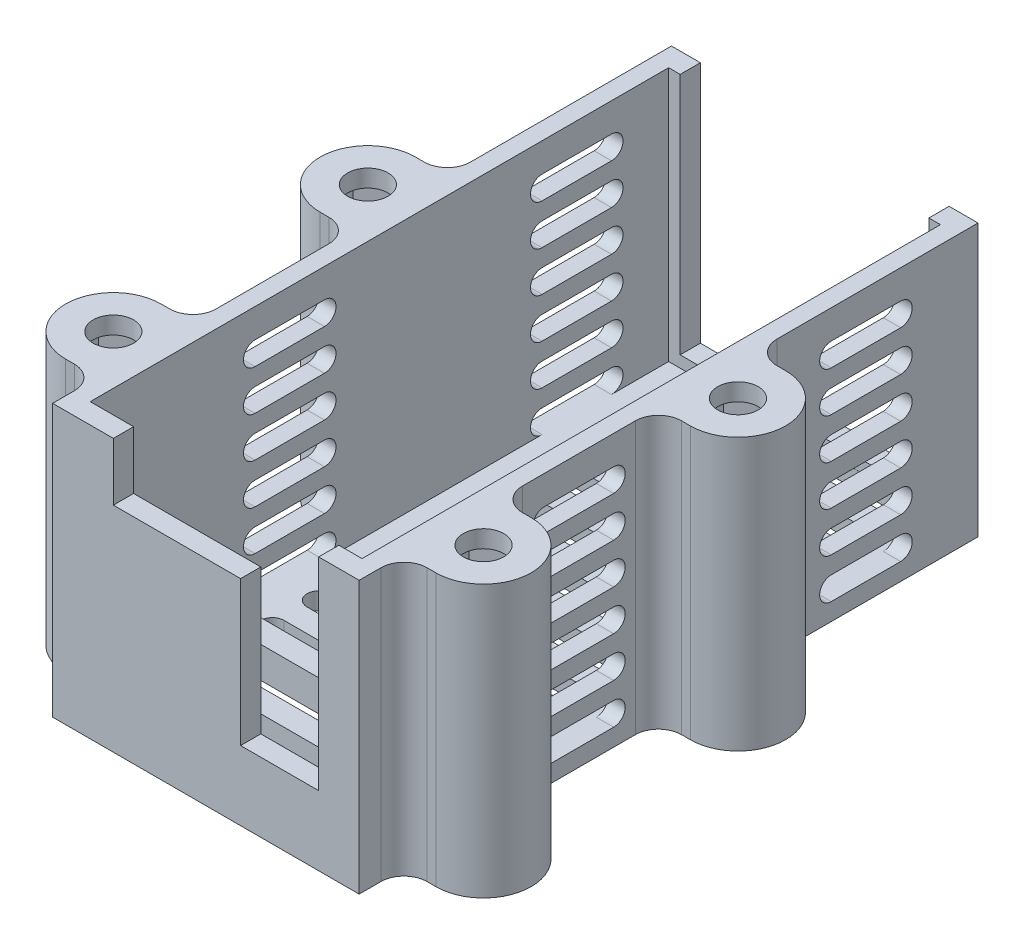
from build123d import *

# Parameters (mm, degrees)
SKETCH1_R           = 1.75
BOSS_EXTRUDE2_DEPTH = 1.5
SKETCH2_R           = 1.75
SKETCH2_W           = 23.5
SKETCH2_H           = 50.005253482
BOSS_EXTRUDE3_DEPTH = 22
SKETCH3_W           = 21.5
SKETCH3_H           = 1.747373259
CUT_EXTRUDE1_DEPTH  = 21
CUT_EXTRUDE2_REACH  = 63.802
SKETCH4_W           = 11
SKETCH4_H           = 2
SKETCH4_W_2         = 5
SKETCH4_H_2         = 3
CUT_EXTRUDE3_DEPTH  = 22
CUT_EXTRUDE4_REACH  = 42.9
SKETCH7_W           = 23.5
SKETCH7_H           = 2
BOSS_EXTRUDE4_DEPTH = 1.2
CUT_EXTRUDE5_REACH  = 50.803
FILLET1_R           = 2


with BuildPart() as part:
    # Sketch1 → Boss-Extrude2 (new body)
    with BuildSketch(Plane(origin=(0, 0, 0), x_dir=(1, 0, 0), z_dir=(0, 1, 0))):
        with BuildLine():
            Line((13.25, -26.75), (13.25, -22.875))
            Line((13.25, -22.875), (16, -22.875))
            ThreePointArc((16, -22.875), (20.125, -18.75), (16, -14.625))
            Line((16, -14.625), (13.25, -14.625))
            Line((13.25, -14.625), (13.25, -0.875))
            Line((13.25, -0.875), (16, -0.875))
            ThreePointArc((16, -0.875), (20.125, 3.25), (16, 7.375))
            Line((16, 7.375), (13.25, 7.375))
            Line((13.25, 7.375), (13.25, 26.75))
            Line((13.25, 26.75), (-13.25, 26.75))
            Line((-13.25, 26.75), (-13.25, 7.375))
            Line((-13.25, 7.375), (-16, 7.375))
            ThreePointArc((-16, 7.375), (-20.125, 3.25), (-16, -0.875))
            Line((-16, -0.875), (-13.25, -0.875))
            Line((-13.25, -0.875), (-13.25, -14.625))
            Line((-13.25, -14.625), (-16, -14.625))
            ThreePointArc((-16, -14.625), (-20.125, -18.75), (-16, -22.875))
            Line((-16, -22.875), (-13.25, -22.875))
            Line((-13.25, -22.875), (-13.25, -26.75))
            Line((-13.25, -26.75), (13.25, -26.75))
        make_face()
        with Locations(Location((16, -18.75, 0), (0, 0, 270))):
            Circle(SKETCH1_R, mode=Mode.SUBTRACT)
        with Locations(Location((-16, 3.25, 0), (0, 0, 270))):
            Circle(SKETCH1_R, mode=Mode.SUBTRACT)
        with Locations(Location((16, 3.25, 0), (0, 0, 270))):
            Circle(SKETCH1_R, mode=Mode.SUBTRACT)
        with Locations(Location((-16, -18.75, 0), (0, 0, 270))):
            Circle(SKETCH1_R, mode=Mode.SUBTRACT)
    extrude(amount=BOSS_EXTRUDE2_DEPTH)

    # Sketch2 → Boss-Extrude3 (add)
    with BuildSketch(Plane(origin=(0, 1.5, 0), x_dir=(1, 0, 0), z_dir=(0, 1, 0))):
        with BuildLine():
            Line((13.25, 26.75), (-13.25, 26.75))
            Line((-13.25, 26.75), (-13.25, 7.375))
            Line((-13.25, 7.375), (-16, 7.375))
            ThreePointArc((-16, 7.375), (-20.125, 3.25), (-16, -0.875))
            Line((-16, -0.875), (-13.25, -0.875))
            Line((-13.25, -0.875), (-13.25, -14.625))
            Line((-13.25, -14.625), (-16, -14.625))
            ThreePointArc((-16, -14.625), (-20.125, -18.75), (-16, -22.875))
            Line((-16, -22.875), (-13.25, -22.875))
            Line((-13.25, -22.875), (-13.25, -26.75))
            Line((-13.25, -26.75), (13.25, -26.75))
            Line((13.25, -26.75), (13.25, -22.875))
            Line((13.25, -22.875), (16, -22.875))
            ThreePointArc((16, -22.875), (20.125, -18.75), (16, -14.625))
            Line((16, -14.625), (13.25, -14.625))
            Line((13.25, -14.625), (13.25, -0.875))
            Line((13.25, -0.875), (16, -0.875))
            ThreePointArc((16, -0.875), (20.125, 3.25), (16, 7.375))
            Line((16, 7.375), (13.25, 7.375))
            Line((13.25, 7.375), (13.25, 26.75))
        make_face()
        with Locations(Location((-16, 3.25, 0), (0, 0, 270))):
            Circle(SKETCH2_R, mode=Mode.SUBTRACT)
        with Locations(Location((-16, -18.75, 0), (0, 0, 270))):
            Circle(SKETCH2_R, mode=Mode.SUBTRACT)
        with Locations(Location((16, -18.75, 0), (0, 0, 270))):
            Circle(SKETCH2_R, mode=Mode.SUBTRACT)
        with Locations(Location((16, 3.25, 0), (0, 0, 270))):
            Circle(SKETCH2_R, mode=Mode.SUBTRACT)
        Rectangle(SKETCH2_W, SKETCH2_H, mode=Mode.SUBTRACT)
    extrude(amount=BOSS_EXTRUDE3_DEPTH)

    # Sketch3 → Cut-Extrude1 (cut)
    with BuildSketch(Plane(origin=(0, 23.5, 0), x_dir=(1, 0, 0), z_dir=(0, 1, 0))):
        with Locations((0, 25.876313371)):
            Rectangle(SKETCH3_W, SKETCH3_H)
    extrude(amount=-CUT_EXTRUDE1_DEPTH, mode=Mode.SUBTRACT)

    # Sketch4 → Cut-Extrude2 (cut, up to next)
    with BuildSketch(Plane.XY.offset(26.75), mode=Mode.PRIVATE) as cut_extrude2_sk1:
        with Locations((-2.5, 22.5)):
            Rectangle(SKETCH4_W, SKETCH4_H)
    cut_extrude2_tool1 = extrude(cut_extrude2_sk1.sketch, amount=-CUT_EXTRUDE2_REACH, mode=Mode.PRIVATE) & part.part
    # Sketch4 → Cut-Extrude2 (cut, up to next)
    with BuildSketch(Plane.XY.offset(26.75), mode=Mode.PRIVATE) as cut_extrude2_sk2:
        with Locations((5.5, 22.5)):
            Rectangle(SKETCH4_W_2, SKETCH4_H)
    cut_extrude2_tool2 = extrude(cut_extrude2_sk2.sketch, amount=-CUT_EXTRUDE2_REACH, mode=Mode.PRIVATE) & part.part
    # Sketch4 → Cut-Extrude2 (cut, up to next)
    with BuildSketch(Plane.XY.offset(26.75), mode=Mode.PRIVATE) as cut_extrude2_sk3:
        Polygon((3, 6), (9.75, 6), (9.75, 23.5), (8, 23.5), (8, 21.5), (8, 18.5), (3, 18.5), align=None)
    cut_extrude2_tool3 = extrude(cut_extrude2_sk3.sketch, amount=-CUT_EXTRUDE2_REACH, mode=Mode.PRIVATE) & part.part
    # Sketch4 → Cut-Extrude2 (cut, up to next)
    with BuildSketch(Plane.XY.offset(26.75), mode=Mode.PRIVATE) as cut_extrude2_sk4:
        with Locations((5.5, 20)):
            Rectangle(SKETCH4_W_2, SKETCH4_H_2)
    cut_extrude2_tool4 = extrude(cut_extrude2_sk4.sketch, amount=-CUT_EXTRUDE2_REACH, mode=Mode.PRIVATE) & part.part
    # Sketch4 → Cut-Extrude2 (cut, up to next)
    with BuildSketch(Plane.XY.offset(26.75), mode=Mode.PRIVATE) as cut_extrude2_sk5:
        with Locations((-2.5, 20)):
            Rectangle(SKETCH4_W, SKETCH4_H_2)
    cut_extrude2_tool5 = extrude(cut_extrude2_sk5.sketch, amount=-CUT_EXTRUDE2_REACH, mode=Mode.PRIVATE) & part.part
    add(cut_extrude2_tool1.solids().sort_by_distance((-2.5, 22.5, 26.75))[0], mode=Mode.SUBTRACT)
    add(cut_extrude2_tool2.solids().sort_by_distance((5.5, 22.5, 26.75))[0], mode=Mode.SUBTRACT)
    add(cut_extrude2_tool3.solids().sort_by_distance((6.609899, 13.072148, 26.75))[0], mode=Mode.SUBTRACT)
    add(cut_extrude2_tool4.solids().sort_by_distance((5.5, 20, 26.75))[0], mode=Mode.SUBTRACT)
    add(cut_extrude2_tool5.solids().sort_by_distance((-2.5, 20, 26.75))[0], mode=Mode.SUBTRACT)

    # Sketch5 → Cut-Extrude3 (cut)
    with BuildSketch(Plane.XZ):
        Polygon((-16, 15.285898385), (-13, 17.017949192), (-13, 20.482050808), (-16, 22.214101615), (-19, 20.482050808), (-19, 17.017949192), align=None)
        Polygon((16, 15.285898385), (19, 17.017949192), (19, 20.482050808), (16, 22.214101615), (13, 20.482050808), (13, 17.017949192), align=None)
        Polygon((16, -6.714101615), (19, -4.982050808), (19, -1.517949192), (16, 0.214101615), (13, -1.517949192), (13, -4.982050808), align=None)
        Polygon((-16, -6.714101615), (-13, -4.982050808), (-13, -1.517949192), (-16, 0.214101615), (-19, -1.517949192), (-19, -4.982050808), align=None)
    extrude(amount=-CUT_EXTRUDE3_DEPTH, mode=Mode.SUBTRACT)

    # Sketch6 → Cut-Extrude4 (cut, up to next)
    with BuildSketch(Plane.XZ, mode=Mode.PRIVATE) as cut_extrude4_sk1:
        with BuildLine():
            Line((-9, 1), (9, 1))
            ThreePointArc((9, 1), (10, 0), (9, -1))
            Line((9, -1), (-9, -1))
            ThreePointArc((-9, -1), (-10, 0), (-9, 1))
        make_face()
    cut_extrude4_tool1 = extrude(cut_extrude4_sk1.sketch, amount=-CUT_EXTRUDE4_REACH, mode=Mode.PRIVATE) & part.part
    # Sketch6 → Cut-Extrude4 (cut, up to next)
    with BuildSketch(Plane.XZ, mode=Mode.PRIVATE) as cut_extrude4_sk2:
        with BuildLine():
            Line((-9, 5), (9, 5))
            ThreePointArc((9, 5), (10, 4), (9, 3))
            Line((9, 3), (-9, 3))
            ThreePointArc((-9, 3), (-10, 4), (-9, 5))
        make_face()
    cut_extrude4_tool2 = extrude(cut_extrude4_sk2.sketch, amount=-CUT_EXTRUDE4_REACH, mode=Mode.PRIVATE) & part.part
    # Sketch6 → Cut-Extrude4 (cut, up to next)
    with BuildSketch(Plane.XZ, mode=Mode.PRIVATE) as cut_extrude4_sk3:
        with BuildLine():
            Line((-9, 9), (9, 9))
            ThreePointArc((9, 9), (10, 8), (9, 7))
            Line((9, 7), (-9, 7))
            ThreePointArc((-9, 7), (-10, 8), (-9, 9))
        make_face()
    cut_extrude4_tool3 = extrude(cut_extrude4_sk3.sketch, amount=-CUT_EXTRUDE4_REACH, mode=Mode.PRIVATE) & part.part
    # Sketch6 → Cut-Extrude4 (cut, up to next)
    with BuildSketch(Plane.XZ, mode=Mode.PRIVATE) as cut_extrude4_sk4:
        with BuildLine():
            Line((-9, 13), (9, 13))
            ThreePointArc((9, 13), (10, 12), (9, 11))
            Line((9, 11), (-9, 11))
            ThreePointArc((-9, 11), (-10, 12), (-9, 13))
        make_face()
    cut_extrude4_tool4 = extrude(cut_extrude4_sk4.sketch, amount=-CUT_EXTRUDE4_REACH, mode=Mode.PRIVATE) & part.part
    # Sketch6 → Cut-Extrude4 (cut, up to next)
    with BuildSketch(Plane.XZ, mode=Mode.PRIVATE) as cut_extrude4_sk5:
        with BuildLine():
            Line((-9, 17), (9, 17))
            ThreePointArc((9, 17), (10, 16), (9, 15))
            Line((9, 15), (-9, 15))
            ThreePointArc((-9, 15), (-10, 16), (-9, 17))
        make_face()
    cut_extrude4_tool5 = extrude(cut_extrude4_sk5.sketch, amount=-CUT_EXTRUDE4_REACH, mode=Mode.PRIVATE) & part.part
    # Sketch6 → Cut-Extrude4 (cut, up to next)
    with BuildSketch(Plane.XZ, mode=Mode.PRIVATE) as cut_extrude4_sk6:
        with BuildLine():
            Line((-9, 21), (9, 21))
            ThreePointArc((9, 21), (10, 20), (9, 19))
            Line((9, 19), (-9, 19))
            ThreePointArc((-9, 19), (-10, 20), (-9, 21))
        make_face()
    cut_extrude4_tool6 = extrude(cut_extrude4_sk6.sketch, amount=-CUT_EXTRUDE4_REACH, mode=Mode.PRIVATE) & part.part
    # Sketch6 → Cut-Extrude4 (cut, up to next)
    with BuildSketch(Plane.XZ, mode=Mode.PRIVATE) as cut_extrude4_sk7:
        with BuildLine():
            Line((-9, 25), (9, 25))
            ThreePointArc((9, 25), (10, 24), (9, 23))
            Line((9, 23), (-9, 23))
            ThreePointArc((-9, 23), (-10, 24), (-9, 25))
        make_face()
    cut_extrude4_tool7 = extrude(cut_extrude4_sk7.sketch, amount=-CUT_EXTRUDE4_REACH, mode=Mode.PRIVATE) & part.part
    # Sketch6 → Cut-Extrude4 (cut, up to next)
    with BuildSketch(Plane.XZ, mode=Mode.PRIVATE) as cut_extrude4_sk8:
        with BuildLine():
            Line((-9, -5), (9, -5))
            ThreePointArc((9, -5), (10, -4), (9, -3))
            Line((9, -3), (-9, -3))
            ThreePointArc((-9, -3), (-10, -4), (-9, -5))
        make_face()
    cut_extrude4_tool8 = extrude(cut_extrude4_sk8.sketch, amount=-CUT_EXTRUDE4_REACH, mode=Mode.PRIVATE) & part.part
    # Sketch6 → Cut-Extrude4 (cut, up to next)
    with BuildSketch(Plane.XZ, mode=Mode.PRIVATE) as cut_extrude4_sk9:
        with BuildLine():
            Line((-9, -9), (9, -9))
            ThreePointArc((9, -9), (10, -8), (9, -7))
            Line((9, -7), (-9, -7))
            ThreePointArc((-9, -7), (-10, -8), (-9, -9))
        make_face()
    cut_extrude4_tool9 = extrude(cut_extrude4_sk9.sketch, amount=-CUT_EXTRUDE4_REACH, mode=Mode.PRIVATE) & part.part
    # Sketch6 → Cut-Extrude4 (cut, up to next)
    with BuildSketch(Plane.XZ, mode=Mode.PRIVATE) as cut_extrude4_sk10:
        with BuildLine():
            Line((-9, -13), (9, -13))
            ThreePointArc((9, -13), (10, -12), (9, -11))
            Line((9, -11), (-9, -11))
            ThreePointArc((-9, -11), (-10, -12), (-9, -13))
        make_face()
    cut_extrude4_tool10 = extrude(cut_extrude4_sk10.sketch, amount=-CUT_EXTRUDE4_REACH, mode=Mode.PRIVATE) & part.part
    # Sketch6 → Cut-Extrude4 (cut, up to next)
    with BuildSketch(Plane.XZ, mode=Mode.PRIVATE) as cut_extrude4_sk11:
        with BuildLine():
            Line((-9, -17), (9, -17))
            ThreePointArc((9, -17), (10, -16), (9, -15))
            Line((9, -15), (-9, -15))
            ThreePointArc((-9, -15), (-10, -16), (-9, -17))
        make_face()
    cut_extrude4_tool11 = extrude(cut_extrude4_sk11.sketch, amount=-CUT_EXTRUDE4_REACH, mode=Mode.PRIVATE) & part.part
    # Sketch6 → Cut-Extrude4 (cut, up to next)
    with BuildSketch(Plane.XZ, mode=Mode.PRIVATE) as cut_extrude4_sk12:
        with BuildLine():
            Line((-9, -21), (9, -21))
            ThreePointArc((9, -21), (10, -20), (9, -19))
            Line((9, -19), (-9, -19))
            ThreePointArc((-9, -19), (-10, -20), (-9, -21))
        make_face()
    cut_extrude4_tool12 = extrude(cut_extrude4_sk12.sketch, amount=-CUT_EXTRUDE4_REACH, mode=Mode.PRIVATE) & part.part
    # Sketch6 → Cut-Extrude4 (cut, up to next)
    with BuildSketch(Plane.XZ, mode=Mode.PRIVATE) as cut_extrude4_sk13:
        with BuildLine():
            Line((-9, -25), (9, -25))
            ThreePointArc((9, -25), (10, -24), (9, -23))
            Line((9, -23), (-9, -23))
            ThreePointArc((-9, -23), (-10, -24), (-9, -25))
        make_face()
    cut_extrude4_tool13 = extrude(cut_extrude4_sk13.sketch, amount=-CUT_EXTRUDE4_REACH, mode=Mode.PRIVATE) & part.part
    add(cut_extrude4_tool1.solids().sort_by_distance((0, 0, 0))[0], mode=Mode.SUBTRACT)
    add(cut_extrude4_tool2.solids().sort_by_distance((0, 0, 4))[0], mode=Mode.SUBTRACT)
    add(cut_extrude4_tool3.solids().sort_by_distance((0, 0, 8))[0], mode=Mode.SUBTRACT)
    add(cut_extrude4_tool4.solids().sort_by_distance((0, 0, 12))[0], mode=Mode.SUBTRACT)
    add(cut_extrude4_tool5.solids().sort_by_distance((0, 0, 16))[0], mode=Mode.SUBTRACT)
    add(cut_extrude4_tool6.solids().sort_by_distance((0, 0, 20))[0], mode=Mode.SUBTRACT)
    add(cut_extrude4_tool7.solids().sort_by_distance((0, 0, 24))[0], mode=Mode.SUBTRACT)
    add(cut_extrude4_tool8.solids().sort_by_distance((0, 0, -4))[0], mode=Mode.SUBTRACT)
    add(cut_extrude4_tool9.solids().sort_by_distance((0, 0, -8))[0], mode=Mode.SUBTRACT)
    add(cut_extrude4_tool10.solids().sort_by_distance((0, 0, -12))[0], mode=Mode.SUBTRACT)
    add(cut_extrude4_tool11.solids().sort_by_distance((0, 0, -16))[0], mode=Mode.SUBTRACT)
    add(cut_extrude4_tool12.solids().sort_by_distance((0, 0, -20))[0], mode=Mode.SUBTRACT)
    add(cut_extrude4_tool13.solids().sort_by_distance((0, 0, -24))[0], mode=Mode.SUBTRACT)

    # Sketch7 → Boss-Extrude4 (add)
    with BuildSketch(Plane(origin=(0, 1.5, 0), x_dir=(1, 0, 0), z_dir=(0, 1, 0))):
        with Locations((0, -14)):
            Rectangle(SKETCH7_W, SKETCH7_H)
    extrude(amount=BOSS_EXTRUDE4_DEPTH)

    # Cut-Extrude5: up to this face of the body (flat: up to its plane)
    cut_extrude5_end = Plane(part.part.faces().sort_by_distance((-13.25, 11.75, -17.0625))[0])
    # Sketch8 → Cut-Extrude5 (cut, up to the picked face)
    with BuildSketch(Plane(origin=(13.25, 0, 0), x_dir=(0, 0, -1), z_dir=(1, 0, 0)), mode=Mode.PRIVATE) as cut_extrude5_sk1:
        with BuildLine():
            Line((-10.75, 3.5), (-4.75, 3.5))
            ThreePointArc((-4.75, 3.5), (-3.75, 2.5), (-4.75, 1.5))
            Line((-4.75, 1.5), (-10.75, 1.5))
            ThreePointArc((-10.75, 1.5), (-11.75, 2.5), (-10.75, 3.5))
        make_face()
    cut_extrude5_tool1 = split(extrude(cut_extrude5_sk1.sketch, amount=-CUT_EXTRUDE5_REACH, mode=Mode.PRIVATE), bisect_by=cut_extrude5_end, keep=Keep.BOTH, mode=Mode.PRIVATE)
    # Sketch8 → Cut-Extrude5 (cut, up to the picked face)
    with BuildSketch(Plane(origin=(13.25, 0, 0), x_dir=(0, 0, -1), z_dir=(1, 0, 0)), mode=Mode.PRIVATE) as cut_extrude5_sk2:
        with BuildLine():
            Line((14.0625, 3.5), (20.0625, 3.5))
            ThreePointArc((20.0625, 3.5), (21.0625, 2.5), (20.0625, 1.5))
            Line((20.0625, 1.5), (14.0625, 1.5))
            ThreePointArc((14.0625, 1.5), (13.0625, 2.5), (14.0625, 3.5))
        make_face()
    cut_extrude5_tool2 = split(extrude(cut_extrude5_sk2.sketch, amount=-CUT_EXTRUDE5_REACH, mode=Mode.PRIVATE), bisect_by=cut_extrude5_end, keep=Keep.BOTH, mode=Mode.PRIVATE)
    # Sketch8 → Cut-Extrude5 (cut, up to the picked face)
    with BuildSketch(Plane(origin=(13.25, 0, 0), x_dir=(0, 0, -1), z_dir=(1, 0, 0)), mode=Mode.PRIVATE) as cut_extrude5_sk3:
        with BuildLine():
            Line((-10.75, 7), (-4.75, 7))
            ThreePointArc((-4.75, 7), (-3.75, 6), (-4.75, 5))
            Line((-4.75, 5), (-10.75, 5))
            ThreePointArc((-10.75, 5), (-11.75, 6), (-10.75, 7))
        make_face()
    cut_extrude5_tool3 = split(extrude(cut_extrude5_sk3.sketch, amount=-CUT_EXTRUDE5_REACH, mode=Mode.PRIVATE), bisect_by=cut_extrude5_end, keep=Keep.BOTH, mode=Mode.PRIVATE)
    # Sketch8 → Cut-Extrude5 (cut, up to the picked face)
    with BuildSketch(Plane(origin=(13.25, 0, 0), x_dir=(0, 0, -1), z_dir=(1, 0, 0)), mode=Mode.PRIVATE) as cut_extrude5_sk4:
        with BuildLine():
            Line((14.0625, 7), (20.0625, 7))
            ThreePointArc((20.0625, 7), (21.0625, 6), (20.0625, 5))
            Line((20.0625, 5), (14.0625, 5))
            ThreePointArc((14.0625, 5), (13.0625, 6), (14.0625, 7))
        make_face()
    cut_extrude5_tool4 = split(extrude(cut_extrude5_sk4.sketch, amount=-CUT_EXTRUDE5_REACH, mode=Mode.PRIVATE), bisect_by=cut_extrude5_end, keep=Keep.BOTH, mode=Mode.PRIVATE)
    # Sketch8 → Cut-Extrude5 (cut, up to the picked face)
    with BuildSketch(Plane(origin=(13.25, 0, 0), x_dir=(0, 0, -1), z_dir=(1, 0, 0)), mode=Mode.PRIVATE) as cut_extrude5_sk5:
        with BuildLine():
            Line((-10.75, 10.5), (-4.75, 10.5))
            ThreePointArc((-4.75, 10.5), (-3.75, 9.5), (-4.75, 8.5))
            Line((-4.75, 8.5), (-10.75, 8.5))
            ThreePointArc((-10.75, 8.5), (-11.75, 9.5), (-10.75, 10.5))
        make_face()
    cut_extrude5_tool5 = split(extrude(cut_extrude5_sk5.sketch, amount=-CUT_EXTRUDE5_REACH, mode=Mode.PRIVATE), bisect_by=cut_extrude5_end, keep=Keep.BOTH, mode=Mode.PRIVATE)
    # Sketch8 → Cut-Extrude5 (cut, up to the picked face)
    with BuildSketch(Plane(origin=(13.25, 0, 0), x_dir=(0, 0, -1), z_dir=(1, 0, 0)), mode=Mode.PRIVATE) as cut_extrude5_sk6:
        with BuildLine():
            Line((14.0625, 10.5), (20.0625, 10.5))
            ThreePointArc((20.0625, 10.5), (21.0625, 9.5), (20.0625, 8.5))
            Line((20.0625, 8.5), (14.0625, 8.5))
            ThreePointArc((14.0625, 8.5), (13.0625, 9.5), (14.0625, 10.5))
        make_face()
    cut_extrude5_tool6 = split(extrude(cut_extrude5_sk6.sketch, amount=-CUT_EXTRUDE5_REACH, mode=Mode.PRIVATE), bisect_by=cut_extrude5_end, keep=Keep.BOTH, mode=Mode.PRIVATE)
    # Sketch8 → Cut-Extrude5 (cut, up to the picked face)
    with BuildSketch(Plane(origin=(13.25, 0, 0), x_dir=(0, 0, -1), z_dir=(1, 0, 0)), mode=Mode.PRIVATE) as cut_extrude5_sk7:
        with BuildLine():
            Line((-10.75, 14), (-4.75, 14))
            ThreePointArc((-4.75, 14), (-3.75, 13), (-4.75, 12))
            Line((-4.75, 12), (-10.75, 12))
            ThreePointArc((-10.75, 12), (-11.75, 13), (-10.75, 14))
        make_face()
    cut_extrude5_tool7 = split(extrude(cut_extrude5_sk7.sketch, amount=-CUT_EXTRUDE5_REACH, mode=Mode.PRIVATE), bisect_by=cut_extrude5_end, keep=Keep.BOTH, mode=Mode.PRIVATE)
    # Sketch8 → Cut-Extrude5 (cut, up to the picked face)
    with BuildSketch(Plane(origin=(13.25, 0, 0), x_dir=(0, 0, -1), z_dir=(1, 0, 0)), mode=Mode.PRIVATE) as cut_extrude5_sk8:
        with BuildLine():
            Line((14.0625, 14), (20.0625, 14))
            ThreePointArc((20.0625, 14), (21.0625, 13), (20.0625, 12))
            Line((20.0625, 12), (14.0625, 12))
            ThreePointArc((14.0625, 12), (13.0625, 13), (14.0625, 14))
        make_face()
    cut_extrude5_tool8 = split(extrude(cut_extrude5_sk8.sketch, amount=-CUT_EXTRUDE5_REACH, mode=Mode.PRIVATE), bisect_by=cut_extrude5_end, keep=Keep.BOTH, mode=Mode.PRIVATE)
    # Sketch8 → Cut-Extrude5 (cut, up to the picked face)
    with BuildSketch(Plane(origin=(13.25, 0, 0), x_dir=(0, 0, -1), z_dir=(1, 0, 0)), mode=Mode.PRIVATE) as cut_extrude5_sk9:
        with BuildLine():
            Line((-10.75, 17.5), (-4.75, 17.5))
            ThreePointArc((-4.75, 17.5), (-3.75, 16.5), (-4.75, 15.5))
            Line((-4.75, 15.5), (-10.75, 15.5))
            ThreePointArc((-10.75, 15.5), (-11.75, 16.5), (-10.75, 17.5))
        make_face()
    cut_extrude5_tool9 = split(extrude(cut_extrude5_sk9.sketch, amount=-CUT_EXTRUDE5_REACH, mode=Mode.PRIVATE), bisect_by=cut_extrude5_end, keep=Keep.BOTH, mode=Mode.PRIVATE)
    # Sketch8 → Cut-Extrude5 (cut, up to the picked face)
    with BuildSketch(Plane(origin=(13.25, 0, 0), x_dir=(0, 0, -1), z_dir=(1, 0, 0)), mode=Mode.PRIVATE) as cut_extrude5_sk10:
        with BuildLine():
            Line((14.0625, 17.5), (20.0625, 17.5))
            ThreePointArc((20.0625, 17.5), (21.0625, 16.5), (20.0625, 15.5))
            Line((20.0625, 15.5), (14.0625, 15.5))
            ThreePointArc((14.0625, 15.5), (13.0625, 16.5), (14.0625, 17.5))
        make_face()
    cut_extrude5_tool10 = split(extrude(cut_extrude5_sk10.sketch, amount=-CUT_EXTRUDE5_REACH, mode=Mode.PRIVATE), bisect_by=cut_extrude5_end, keep=Keep.BOTH, mode=Mode.PRIVATE)
    # Sketch8 → Cut-Extrude5 (cut, up to the picked face)
    with BuildSketch(Plane(origin=(13.25, 0, 0), x_dir=(0, 0, -1), z_dir=(1, 0, 0)), mode=Mode.PRIVATE) as cut_extrude5_sk11:
        with BuildLine():
            Line((-10.75, 21), (-4.75, 21))
            ThreePointArc((-4.75, 21), (-3.75, 20), (-4.75, 19))
            Line((-4.75, 19), (-10.75, 19))
            ThreePointArc((-10.75, 19), (-11.75, 20), (-10.75, 21))
        make_face()
    cut_extrude5_tool11 = split(extrude(cut_extrude5_sk11.sketch, amount=-CUT_EXTRUDE5_REACH, mode=Mode.PRIVATE), bisect_by=cut_extrude5_end, keep=Keep.BOTH, mode=Mode.PRIVATE)
    # Sketch8 → Cut-Extrude5 (cut, up to the picked face)
    with BuildSketch(Plane(origin=(13.25, 0, 0), x_dir=(0, 0, -1), z_dir=(1, 0, 0)), mode=Mode.PRIVATE) as cut_extrude5_sk12:
        with BuildLine():
            Line((14.0625, 21), (20.0625, 21))
            ThreePointArc((20.0625, 21), (21.0625, 20), (20.0625, 19))
            Line((20.0625, 19), (14.0625, 19))
            ThreePointArc((14.0625, 19), (13.0625, 20), (14.0625, 21))
        make_face()
    cut_extrude5_tool12 = split(extrude(cut_extrude5_sk12.sketch, amount=-CUT_EXTRUDE5_REACH, mode=Mode.PRIVATE), bisect_by=cut_extrude5_end, keep=Keep.BOTH, mode=Mode.PRIVATE)
    add(cut_extrude5_tool1.solids().sort_by(Axis((13.25, 2.5, 7.75), (-1, 0, 0)))[0], mode=Mode.SUBTRACT)
    add(cut_extrude5_tool2.solids().sort_by(Axis((13.25, 2.5, -17.0625), (-1, 0, 0)))[0], mode=Mode.SUBTRACT)
    add(cut_extrude5_tool3.solids().sort_by(Axis((13.25, 6, 7.75), (-1, 0, 0)))[0], mode=Mode.SUBTRACT)
    add(cut_extrude5_tool4.solids().sort_by(Axis((13.25, 6, -17.0625), (-1, 0, 0)))[0], mode=Mode.SUBTRACT)
    add(cut_extrude5_tool5.solids().sort_by(Axis((13.25, 9.5, 7.75), (-1, 0, 0)))[0], mode=Mode.SUBTRACT)
    add(cut_extrude5_tool6.solids().sort_by(Axis((13.25, 9.5, -17.0625), (-1, 0, 0)))[0], mode=Mode.SUBTRACT)
    add(cut_extrude5_tool7.solids().sort_by(Axis((13.25, 13, 7.75), (-1, 0, 0)))[0], mode=Mode.SUBTRACT)
    add(cut_extrude5_tool8.solids().sort_by(Axis((13.25, 13, -17.0625), (-1, 0, 0)))[0], mode=Mode.SUBTRACT)
    add(cut_extrude5_tool9.solids().sort_by(Axis((13.25, 16.5, 7.75), (-1, 0, 0)))[0], mode=Mode.SUBTRACT)
    add(cut_extrude5_tool10.solids().sort_by(Axis((13.25, 16.5, -17.0625), (-1, 0, 0)))[0], mode=Mode.SUBTRACT)
    add(cut_extrude5_tool11.solids().sort_by(Axis((13.25, 20, 7.75), (-1, 0, 0)))[0], mode=Mode.SUBTRACT)
    add(cut_extrude5_tool12.solids().sort_by(Axis((13.25, 20, -17.0625), (-1, 0, 0)))[0], mode=Mode.SUBTRACT)

    # Fillet1
    fillet1_edges = [part.edges().sort_by_distance(p)[0] for p in [
        (13.25, 11.75, 22.875),
        (-13.25, 11.75, 22.875),
        (-13.25, 11.75, 14.625),
        (-13.25, 11.75, 0.875),
        (-13.25, 11.75, -7.375),
        (13.25, 11.75, -7.375),
        (13.25, 11.75, 0.875),
        (13.25, 11.75, 14.625),
    ]]
    fillet(fillet1_edges, radius=FILLET1_R)


solid = part.part
